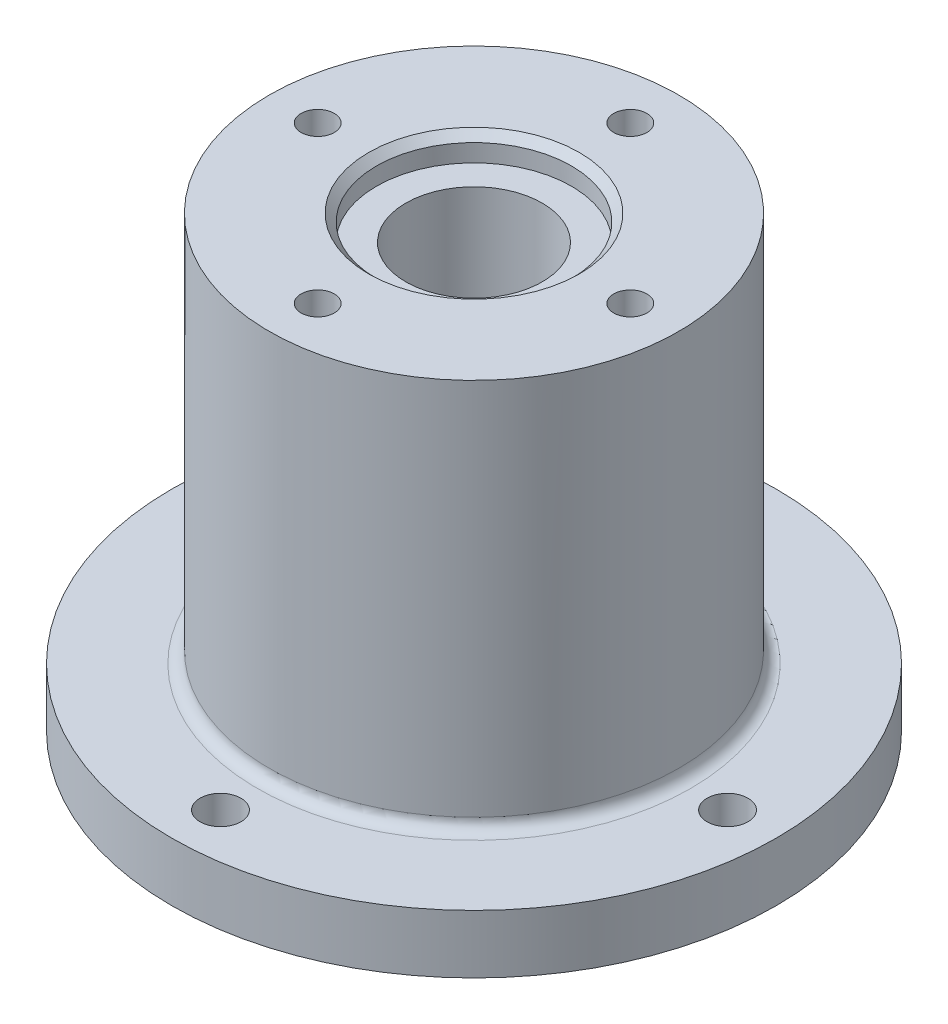
from build123d import *

# Parameters (mm, degrees)
FILLET1_R                    = 3
FILLET2_R                    = 5
FILLET3_R                    = 2.5
CHAMFER1_SIZE                = 2
M10_CLEARANCE_HOLE2_D        = 10.5
R_P_TITION_CIRCULAIRE1_COUNT = 4


with BuildPart() as part:
    # Sketch2 → Revolve1 (revolve)
    with BuildSketch(Plane.XY, mode=Mode.PRIVATE) as revolve1_sk:
        with BuildLine():
            Line((25, 115), (25, 108.5))
            Line((25, 108.5), (17.5, 108.5))
            Line((17.5, 108.5), (17.5, 51))
            Line((17.5, 51), (8, 51))
            Line((8, 51), (8, 35))
            Line((8, 35), (14.405989232, 35))
            ThreePointArc((14.405989232, 35), (16.905989232, 34.330127019), (18.736116251, 32.5))
            Line((18.736116251, 32.5), (37.5, 0))
            Line((37.5, 0), (77.5, 0))
            Line((77.5, 0), (77.5, 15))
            Line((77.5, 15), (52.5, 15))
            Line((52.5, 15), (52.5, 115))
            Line((52.5, 115), (25, 115))
        make_face()
    revolve(revolve1_sk.sketch.rotate(Axis((0, -0.774116112, 0), (0, -1, 0)), 180), axis=Axis((0, -0.774116112, 0), (0, -1, 0)))

    # Fillet1
    fillet1_edges = [part.edges().sort_by_distance(p)[0] for p in [
        (52.5, 15, 0),
    ]]
    fillet(fillet1_edges, radius=FILLET1_R)

    # Fillet2
    fillet2_edges = [part.edges().sort_by_distance(p)[0] for p in [
        (37.5, 0, 0),
    ]]
    fillet(fillet2_edges, radius=FILLET2_R)

    # Fillet3
    fillet3_edges = [part.edges().sort_by_distance(p)[0] for p in [
        (17.5, 51, 0),
    ]]
    fillet(fillet3_edges, radius=FILLET3_R)

    # Chamfer1
    chamfer1_edges = [part.edges().sort_by_distance(p)[0] for p in [
        (25, 115, 0),
    ]]
    chamfer(chamfer1_edges, length=CHAMFER1_SIZE)

    # M10 Clearance Hole2 (through all)
    with Locations(Plane(origin=(0, 15, 0), x_dir=(1, 0, 0), z_dir=(0, 1, 0))):
        with Locations((0, 65), (65, 0), (0, -65), (-65, 0)):
            Hole(M10_CLEARANCE_HOLE2_D / 2)

    # Esquisse5 → Trou taraudé M101 (revolve, cut)
    with BuildSketch(Plane(origin=(-40.072621641, 115, 0), x_dir=(0, 0, 1), z_dir=(1, 0, 0))):
        Polygon((0, 0), (0, 30.053657631), (4.25, 27.5), (4.25, 0), align=None)
    trou_taraud_m101 = revolve(axis=Axis((-40.072621641, 121.35, 0), (0, -1, 0)), mode=Mode.SUBTRACT)

    # Répétition circulaire1: Trou taraudé M101 ×4 about axis
    r_p_tition_circulaire1_axis = Axis((0, 0, 0), (0, 1, 0))
    for i in range(1, R_P_TITION_CIRCULAIRE1_COUNT):
        add(trou_taraud_m101.rotate(r_p_tition_circulaire1_axis, i * 360 / R_P_TITION_CIRCULAIRE1_COUNT), mode=Mode.SUBTRACT)


solid = part.part
